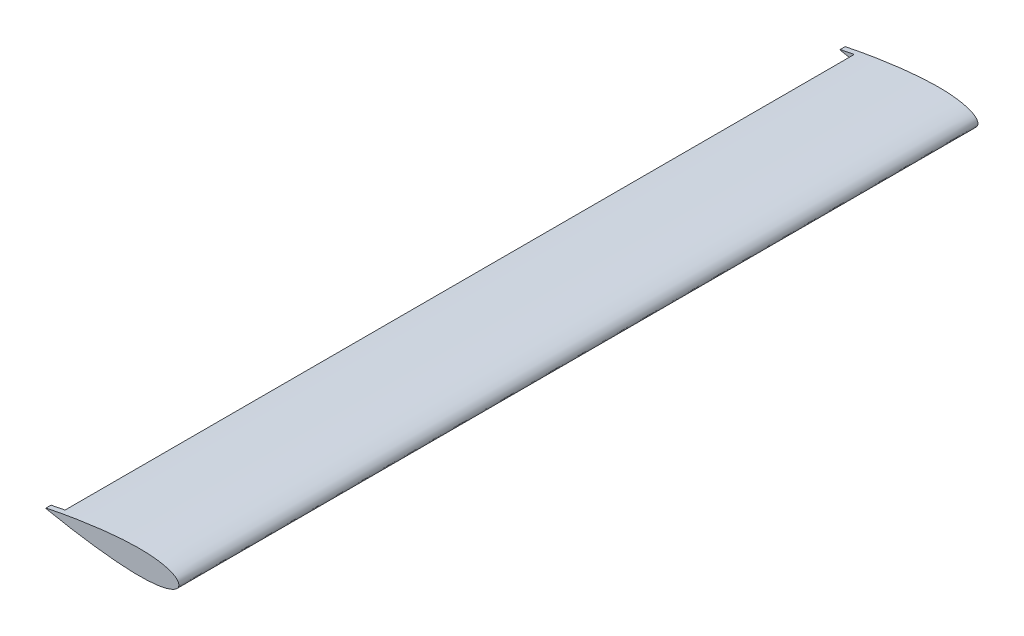
from build123d import *

# Parameters (mm, degrees)
SALIENTE_EXTRUIR1_DEPTH = 800
CORTAR_EXTRUIR1_DEPTH   = 790


with BuildPart() as part:
    # Croquis7 → Saliente-Extruir1 (new, symmetric)
    with BuildSketch(Plane.XY):
        with BuildLine():
            Line((-266, -0.503), (-266, 0.503))
            add(Edge.make_bspline(
                [(-266, 0.503), (-261.568824613, 1.419104937), (-252.716442874, 3.249253805), (-234.995464143, 6.644819917), (-212.843288825, 10.548528836), (-186.239809232, 14.704279801), (-159.64065157, 18.31284697), (-133.040852362, 21.262352518), (-106.434765805, 23.353040106), (-84.236960535, 24.09624082), (-66.489266912, 23.79989373), (-53.167738863, 23.010947545), (-39.821148553, 21.488057179), (-28.71283358, 19.359904545), (-19.852958672, 16.828491563), (-13.087365413, 14.270829652), (-7.419560202, 11.192267863), (-2.207313153, 6.932106723), (1.440351568, 0), (-2.207313153, -6.932106722), (-7.419560202, -11.192267862), (-13.087365413, -14.270829652), (-19.852958672, -16.828491563), (-28.71283358, -19.359904545), (-39.821148553, -21.488057179), (-53.167738863, -23.010947545), (-66.489266912, -23.79989373), (-84.236960535, -24.09624082), (-106.434765805, -23.353040106), (-133.040852362, -21.262352518), (-159.640651569, -18.312846971), (-186.239809232, -14.704279802), (-212.843288824, -10.548528836), (-234.995464143, -6.644819918), (-252.716442874, -3.249253806), (-261.568824613, -1.419104938), (-266, -0.503)],
                knots=[0, 0, 0, 0, 0.024603893, 0.049152434, 0.098108557, 0.146905125, 0.195554767, 0.244056172, 0.292409414, 0.340643605, 0.364753981, 0.388905473, 0.413177962, 0.437756077, 0.450304615, 0.463229875, 0.477067414, 0.485035659, 0.5, 0.514964341, 0.522932586, 0.536770125, 0.549695385, 0.562243923, 0.586822038, 0.611094527, 0.635246019, 0.659356395, 0.707590586, 0.755943828, 0.804445233, 0.853094875, 0.901891443, 0.950847566, 0.975396107, 1, 1, 1, 1], degree=3))
        make_face()
    extrude(amount=SALIENTE_EXTRUIR1_DEPTH, both=True)

    # Croquis8 → Cortar-Extruir1 (cut, symmetric)
    with BuildSketch(Plane.XY):
        with BuildLine():
            Line((-267.930228429, -0.829953534), (-267.930228429, 0.829953533))
            add(Edge.make_bspline(
                [(-267.930228429, 0.829953533), (-257.89023629, 2.582911691), (-247.85024415, 4.335869848), (-237.80774321, 6.073918396)],
                knots=[0, 0, 0, 0, 0.011103805, 0.011103805, 0.011103805, 0.011103805], degree=3))
            Line((-237.80774321, 6.073918396), (-237.80774321, -6.073918396))
            add(Edge.make_bspline(
                [(-237.80774321, -6.073918396), (-247.85024415, -4.335869849), (-257.89023629, -2.582911692), (-267.930228429, -0.829953534)],
                knots=[0.988896195, 0.988896195, 0.988896195, 0.988896195, 1, 1, 1, 1], degree=3))
        make_face()
    extrude(amount=CORTAR_EXTRUIR1_DEPTH, both=True, mode=Mode.SUBTRACT)


solid = part.part
